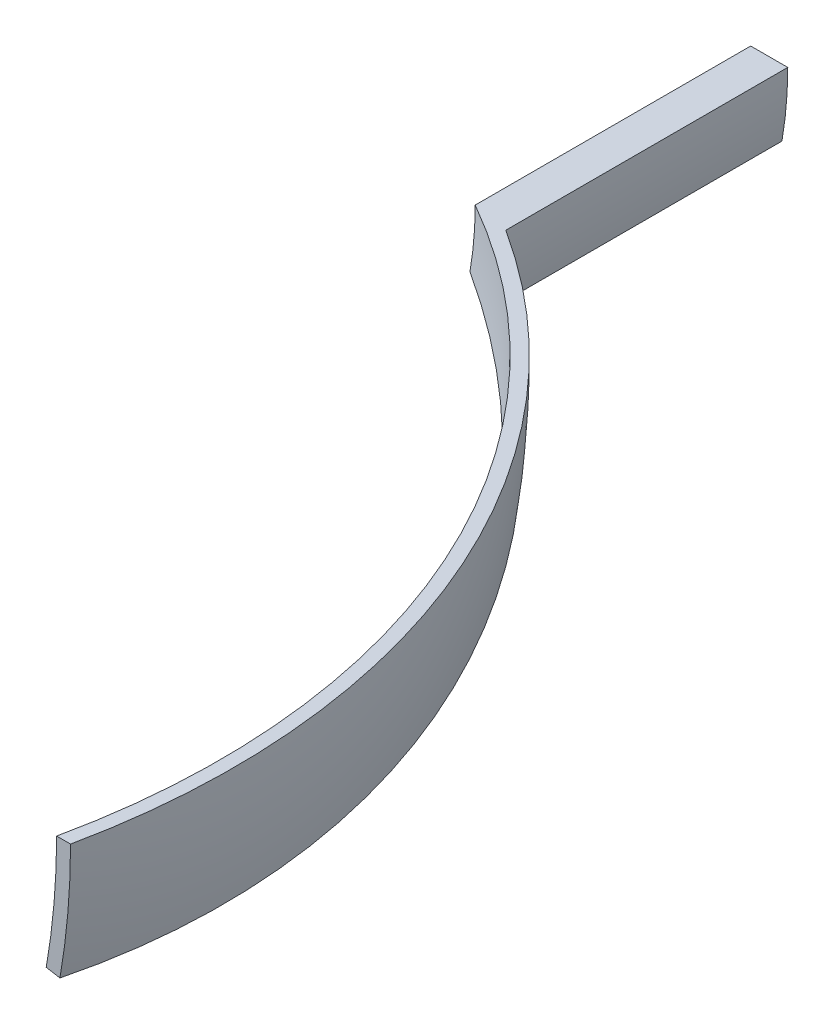
from build123d import *

# Parameters (mm, degrees)
REVOLVE1_ANGLE = 10


with BuildPart() as part:
    # Sketch1 → Revolve1 (revolve)
    with BuildSketch(Plane(origin=(0, 0, 0), x_dir=(1, 0, 0), z_dir=(0, 1, 0))):
        with BuildLine():
            Line((75, 190.7), (83, 190.7))
            Line((83, 190.7), (83, 129.833691726))
            ThreePointArc((83, 129.833691726), (142.120054058, 59.562385293), (150.766644537, -31.862303784))
            Line((150.766644537, -31.862303784), (147.766644537, -31.862303784))
            ThreePointArc((147.766644537, -31.862303784), (138.047901954, 61.587047389), (75, 131.244762334))
            Line((75, 131.244762334), (75, 190.7))
        make_face()
    revolve(axis=Axis((0, 0, 125), (0, 0, -1)), revolution_arc=REVOLVE1_ANGLE)


solid = part.part
